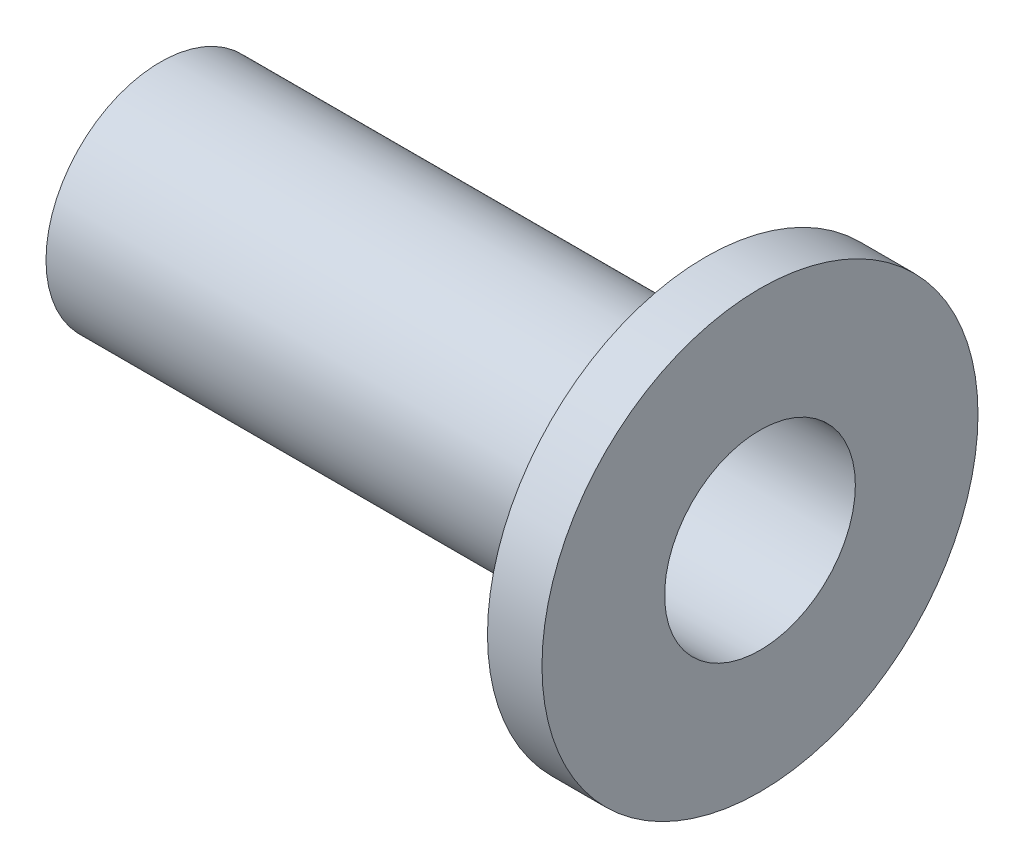
from build123d import *


with BuildPart() as part:
    # Sketch1 → Revolve1 (revolve)
    with BuildSketch(Plane.XY, mode=Mode.PRIVATE) as revolve1_sk:
        Polygon((-106.483217922, 24.9570042), (-96.483217922, 24.9570042), (-96.483217922, 26.8570042), (-95.483217922, 26.8570042), (-95.483217922, 24.6070042), (-106.483217922, 24.6070042), align=None)
    revolve(revolve1_sk.sketch.rotate(Axis((-95.483217922, 22.8570042, 0), (-1, 0, 0)), 90), axis=Axis((-95.483217922, 22.8570042, 0), (-1, 0, 0)))


solid = part.part
